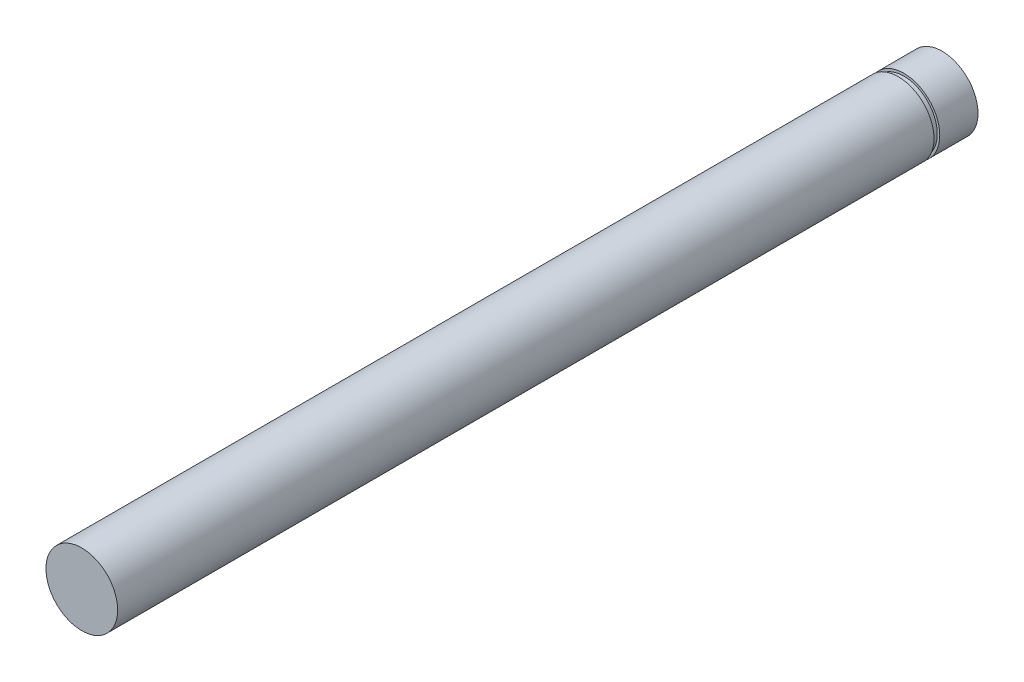
from build123d import *

# Parameters (mm, degrees)
SKETCH1_R           = 2.38125
BOSS_EXTRUDE1_DEPTH = 57.15
CUT_EXTRUDE2_START  = -2.921
SKETCH4_R           = 2.38125
SKETCH4_R_2         = 2.216039323
CUT_EXTRUDE2_DEPTH  = 0.381


with BuildPart() as part:
    # Sketch1 → Boss-Extrude1 (new body)
    with BuildSketch(Plane.XY):
        Circle(SKETCH1_R)
    extrude(amount=-BOSS_EXTRUDE1_DEPTH)

    # Sketch4 → Cut-Extrude2 (cut)
    with BuildSketch(Plane(origin=(0, 0, -57.15), x_dir=(-1, 0, 0), z_dir=(0, 0, -1)).offset(CUT_EXTRUDE2_START)):
        with Locations(Location((0, 0, 0), (0, 0, 180))):
            Circle(SKETCH4_R)
        Circle(SKETCH4_R_2, mode=Mode.SUBTRACT)
    extrude(amount=CUT_EXTRUDE2_DEPTH, mode=Mode.SUBTRACT)


solid = part.part
